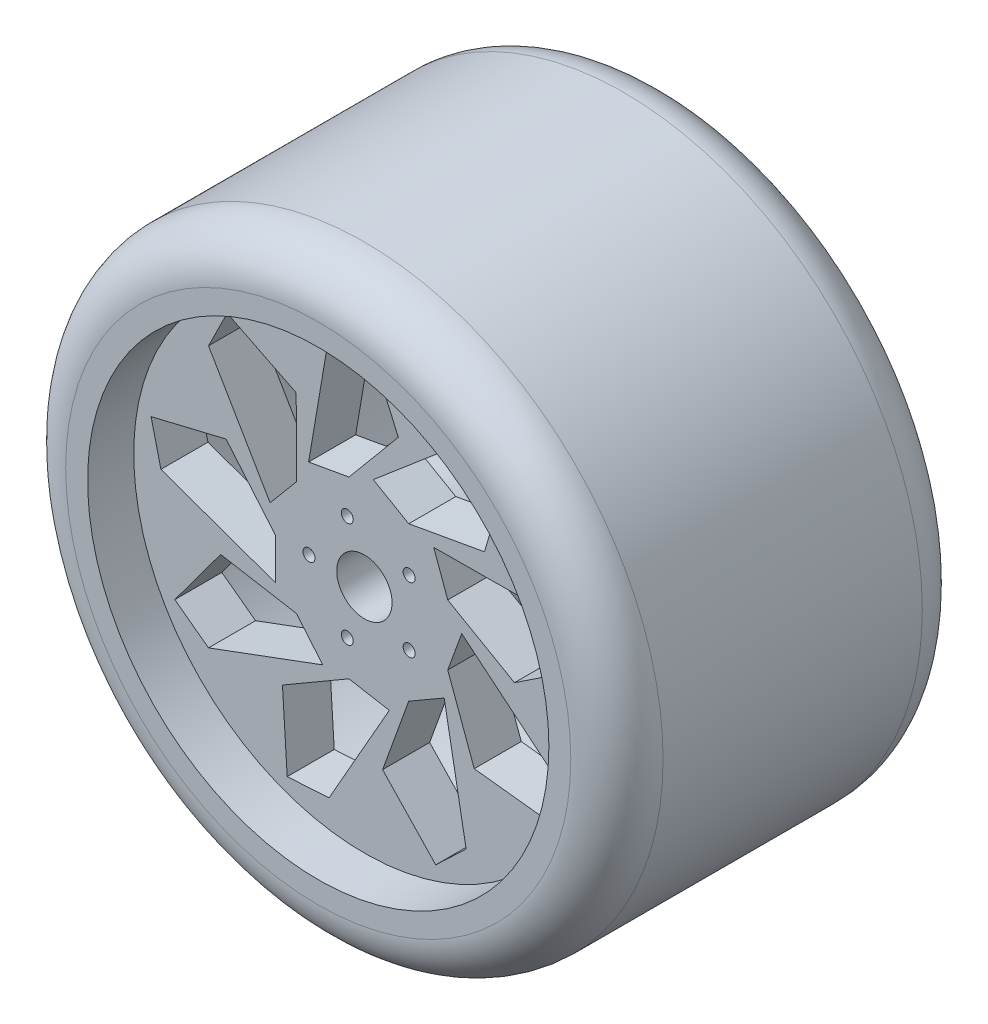
from build123d import *

# Parameters (mm, degrees)
SZKIC1_R                    = 323.75
DODANIE_WYCI_GNI_CIE1_DEPTH = 381
ZAOKR_GLENIE1_R             = 50
SZKIC2_R                    = 6.5
SZKIC2_R_2                  = 30
WYTNIJ_WYCI_GNI_CIE1_DEPTH  = 596.641775734
SZKIC3_R                    = 250
WYTNIJ_WYCI_GNI_CIE2_DEPTH  = 50
WYTNIJ_WYCI_GNI_CIE3_START  = -200
SZKIC4_R                    = 250
WYTNIJ_WYCI_GNI_CIE3_DEPTH  = 200
WYTNIJ_WYCI_GNI_CIE4_DEPTH  = 200
WYTNIJ_WYCI_GNI_CIE5_START  = -80
SZKIC6_R                    = 250
SZKIC6_R_2                  = 85
WYTNIJ_WYCI_GNI_CIE5_DEPTH  = 80


with BuildPart() as part:
    # Szkic1 → Dodanie-wyciągnięcie1 (new body)
    with BuildSketch(Plane.XY):
        Circle(SZKIC1_R)
    extrude(amount=DODANIE_WYCI_GNI_CIE1_DEPTH)

    # Zaokrąglenie1
    zaokr_glenie1_edges = [part.edges().sort_by_distance(p)[0] for p in [
        (-323.75, 0, 0),
        (-323.75, 0, 381),
    ]]
    fillet(zaokr_glenie1_edges, radius=ZAOKR_GLENIE1_R)

    # Szkic2 → Wytnij-wyciągnięcie1 (cut, through all)
    with BuildSketch(Plane.XY.offset(381)):
        with Locations((-60, 0)):
            Circle(SZKIC2_R)
        with Locations((-18.541019662, 57.063390978)):
            Circle(SZKIC2_R)
        with Locations((48.541019662, 35.267115138)):
            Circle(SZKIC2_R)
        with Locations((48.541019662, -35.267115138)):
            Circle(SZKIC2_R)
        with Locations((-18.541019662, -57.063390978)):
            Circle(SZKIC2_R)
        Circle(SZKIC2_R_2)
    extrude(amount=-WYTNIJ_WYCI_GNI_CIE1_DEPTH, mode=Mode.SUBTRACT)

    # Szkic3 → Wytnij-wyciągnięcie2 (cut)
    with BuildSketch(Plane.XY.offset(381)):
        Circle(SZKIC3_R)
    extrude(amount=-WYTNIJ_WYCI_GNI_CIE2_DEPTH, mode=Mode.SUBTRACT)

    # Szkic4 → Wytnij-wyciągnięcie3 (cut)
    with BuildSketch(Plane(origin=(0, 0, 0), x_dir=(-1, 0, 0), z_dir=(0, 0, -1)).offset(WYTNIJ_WYCI_GNI_CIE3_START)):
        with Locations(Location((0, 0, 0), (0, 0, 180))):
            Circle(SZKIC4_R)
    extrude(amount=WYTNIJ_WYCI_GNI_CIE3_DEPTH, mode=Mode.SUBTRACT)

    # Szkic5 → Wytnij-wyciągnięcie4 (cut)
    with BuildSketch(Plane.XY.offset(331)):
        Polygon((-96.155840105, 0), (-149.925673453, 63.746040452), (-231.191444309, 44.19337378), (-220.558452121, 0), (-96.155840105, -44.404647078), align=None)
        Polygon((-102.20240394, 27.791849476), (-73.659646986, 61.807782618), (-73.87456406, 145.202665329), (-148.695968113, 182.461084274), (-168.95757663, 141.772240235), align=None)
        Polygon((-60.427327118, 86.984230788), (-16.697286406, 94.695016833), (36.743274881, 158.71734935), (3.376004134, 235.353225607), (-38.29957328, 217.207673641), align=None)
        Polygon((9.622367637, 105.475723792), (48.077920052, 83.273400253), (130.168527149, 97.966421664), (153.868306527, 178.120977019), (110.279226061, 191.009222556), align=None)
        Polygon((75.169649634, 74.613953402), (90.356933392, 32.887234214), (162.686478902, -8.624083495), (232.36391824, 37.543943689), (207.25714991, 75.435433406), align=None)
        Polygon((105.54421715, 8.839484973), (90.356933392, -32.887234214), (119.081619118, -111.17928414), (202.133870171, -120.600318147), (207.25714991, -75.435433406), align=None)
        Polygon((86.533472468, -61.071076714), (48.077920052, -83.273400253), (19.757146304, -161.712462116), (77.323137782, -222.314350799), (110.279226061, -191.009222556), align=None)
        Polygon((27.032754306, -102.405802878), (-16.697286406, -94.695016833), (-88.811914842, -136.578581834), (-83.667950127, -220.005027963), (-38.29957328, -217.207673641), align=None)
        Polygon((-45.116890032, -95.823715761), (-73.659646986, -61.807782618), (-155.824893999, -47.53806521), (-205.509874305, -114.75290746), (-168.95757663, -141.772240235), align=None)
    extrude(amount=-WYTNIJ_WYCI_GNI_CIE4_DEPTH, mode=Mode.SUBTRACT)

    # Szkic6 → Wytnij-wyciągnięcie5 (cut)
    with BuildSketch(Plane(origin=(0, 0, 200), x_dir=(-1, 0, 0), z_dir=(0, 0, -1)).offset(WYTNIJ_WYCI_GNI_CIE5_START)):
        with Locations(Location((0, 0, 0), (0, 0, 180))):
            Circle(SZKIC6_R)
        Circle(SZKIC6_R_2, mode=Mode.SUBTRACT)
    extrude(amount=WYTNIJ_WYCI_GNI_CIE5_DEPTH, mode=Mode.SUBTRACT)


solid = part.part
